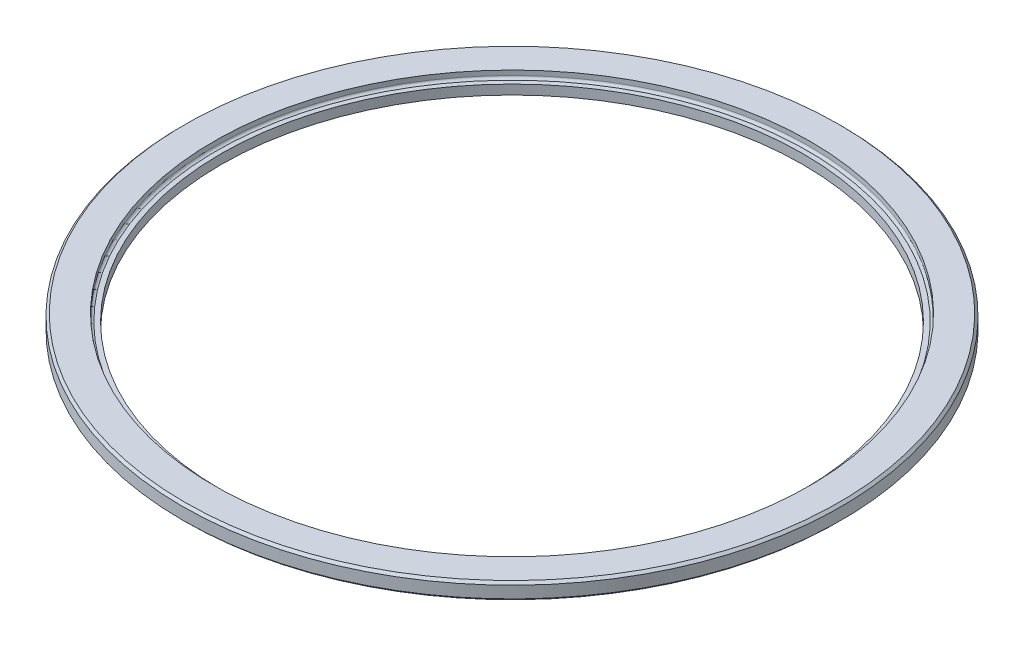
from build123d import *

# Parameters (mm, degrees)
OUTER_CHAMFER_SIZE = 0.254
INNER_FILLET_R     = 0.254


with BuildPart() as part:
    # Primary Sketch → Primary Revolve (revolve)
    with BuildSketch(Plane.XY, mode=Mode.PRIVATE) as primary_revolve_sk:
        Polygon((31.115, 0), (31.115, 1.016), (31.877, 1.016), (31.877, 1.778), (35.2425, 1.778), (35.2425, 0), align=None)
    revolve(primary_revolve_sk.sketch.rotate(Axis((0, 0, 0), (0, 1, 0)), 90), axis=Axis((0, 0, 0), (0, 1, 0)))

    # Outer Chamfer
    outer_chamfer_edges = [part.edges().sort_by_distance(p)[0] for p in [
        (0, 0, 35.2425),
        (0, 1.778, 35.2425),
    ]]
    chamfer(outer_chamfer_edges, length=OUTER_CHAMFER_SIZE)

    # Inner Fillet
    inner_fillet_edges = [part.edges().sort_by_distance(p)[0] for p in [
        (0, 1.016, 31.877),
    ]]
    fillet(inner_fillet_edges, radius=INNER_FILLET_R)


solid = part.part
